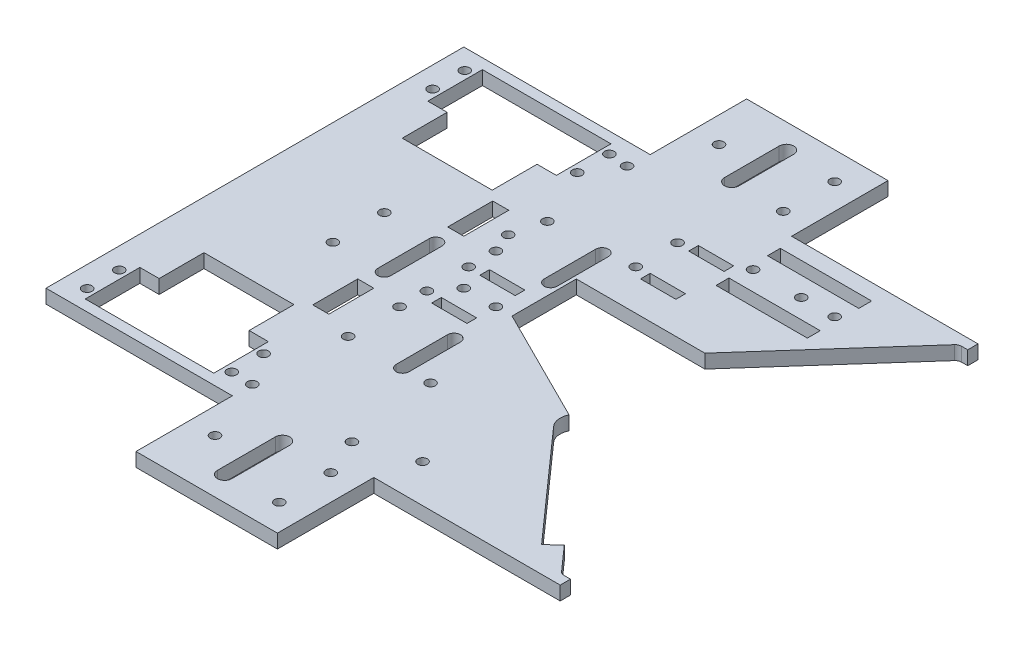
from build123d import *

# Parameters (mm, degrees)
BOSS_EXTRUDE1_DEPTH = 4.3
CUT_EXTRUDE1_DEPTH  = 4.5
FILLET1_R           = 2
CUT_EXTRUDE2_DEPTH  = 10
SKETCH8_R           = 1.5
CUT_EXTRUDE3_DEPTH  = 10
SKETCH9_R           = 1.5
CUT_EXTRUDE4_DEPTH  = 10
CUT_EXTRUDE5_DEPTH  = 10
SKETCH11_R          = 1.5
CUT_EXTRUDE6_DEPTH  = 10
SKETCH12_R          = 1.5
CUT_EXTRUDE7_DEPTH  = 10
SKETCH7_R           = 1.5
SKETCH7_W           = 11
SKETCH7_H           = 3
CUT_EXTRUDE8_DEPTH  = 9
SKETCH13_R          = 1.5
CUT_EXTRUDE9_DEPTH  = 10
SKETCH14_R          = 1.5
CUT_EXTRUDE10_DEPTH = 10
SKETCH15_W          = 5
SKETCH15_H          = 14
CUT_EXTRUDE11_DEPTH = 10
SKETCH16_R          = 1.5
CUT_EXTRUDE12_DEPTH = 10
SKETCH18_R          = 1.5
SKETCH18_W          = 28.4
SKETCH18_H          = 4
CUT_EXTRUDE13_DEPTH = 10


with BuildPart() as part:
    # Sketch2 → Boss-Extrude1 (new body)
    with BuildSketch(Plane(origin=(0, 0, 0), x_dir=(1, 0, 0), z_dir=(0, 1, 0))):
        Polygon((0, 0), (0, 65), (58, 65), (58, 95), (102, 95), (102, 65), (160, 65), (160, 0), align=None)
    extrude(amount=BOSS_EXTRUDE1_DEPTH)

    # Mirror1: part across plane


with BuildPart() as part_1:
    add(part.part)
    add(part.part.mirror(Plane(origin=(0, 4.3, 0), x_dir=(1, 0, 0), z_dir=(0, 0, -1))))

    # Sketch3 → Cut-Extrude1 (cut)
    with BuildSketch(Plane(origin=(0, 4.3, 0), x_dir=(1, 0, 0), z_dir=(0, 1, 0))):
        Polygon((160, -61.8), (160, 61.8), (157.156451185, 61.8), (120.012594795, 20), (80.012594795, 20), (80.012594795, 0), (120, -20), (157.155555556, -61.8), align=None)
    extrude(amount=-CUT_EXTRUDE1_DEPTH, mode=Mode.SUBTRACT)

    # Fillet1
    fillet1_edges = [part_1.edges().sort_by_distance(p)[0] for p in [
        (157.156451185, 2.15, -61.8),
        (157.155555556, 2.15, 61.8),
    ]]
    fillet(fillet1_edges, radius=FILLET1_R)

    # Sketch6 → Cut-Extrude2 (cut)
    with BuildSketch(Plane(origin=(0, 4.3, 0), x_dir=(1, 0, 0), z_dir=(0, 1, 0))):
        Polygon((9, -61.8), (49, -61.8), (49, -44.8), (43, -44.8), (43, -30.841820122), (15, -30.841820122), (15, -44.8), (9, -44.8), align=None)
        Polygon((9, 44.8), (15, 44.8), (15, 30.841820122), (43, 30.841820122), (43, 44.8), (49, 44.8), (49, 61.8), (9, 61.8), align=None)
    extrude(amount=-CUT_EXTRUDE2_DEPTH, mode=Mode.SUBTRACT)

    # Sketch8 → Cut-Extrude3 (cut)
    with BuildSketch(Plane(origin=(0, 4.3, 0), x_dir=(1, 0, 0), z_dir=(0, 1, 0))):
        with Locations((6.5, 58.8)):
            Circle(SKETCH8_R)
        with Locations((6.5, 48.8)):
            Circle(SKETCH8_R)
        with Locations((51.5, 48.8)):
            Circle(SKETCH8_R)
        with Locations((51.5, 58.8)):
            Circle(SKETCH8_R)
        with Locations((6.5, -48.7)):
            Circle(SKETCH8_R)
        with Locations((6.5, -58.7)):
            Circle(SKETCH8_R)
        with Locations((51.5, -58.7)):
            Circle(SKETCH8_R)
        with Locations((51.5, -48.8)):
            Circle(SKETCH8_R)
    extrude(amount=-CUT_EXTRUDE3_DEPTH, mode=Mode.SUBTRACT)

    # Sketch9 → Cut-Extrude4 (cut)
    with BuildSketch(Plane.XZ):
        with Locations((94, 70.4)):
            Circle(SKETCH9_R)
        with Locations((66, 78.4)):
            Circle(SKETCH9_R)
        with Locations((66, -78.4)):
            Circle(SKETCH9_R)
        with Locations((94, -86.4)):
            Circle(SKETCH9_R)
        with Locations((94, 86.4)):
            Circle(SKETCH9_R)
        with Locations((94, -70.4)):
            Circle(SKETCH9_R)
        with BuildLine():
            Line((75.75, 69.4), (75.75, 87.4))
            ThreePointArc((75.75, 87.4), (78, 89.65), (80.25, 87.4))
            Line((80.25, 87.4), (80.25, 69.4))
            ThreePointArc((80.25, 69.4), (78, 67.15), (75.75, 69.4))
        make_face()
        with BuildLine():
            Line((75.75, -87.4), (75.75, -70.4))
            ThreePointArc((75.75, -70.4), (78, -68.15), (80.25, -70.4))
            Line((80.25, -70.4), (80.25, -87.4))
            ThreePointArc((80.25, -87.4), (78, -89.65), (75.75, -87.4))
        make_face()
    extrude(amount=-CUT_EXTRUDE4_DEPTH, mode=Mode.SUBTRACT)

    # Sketch10 → Cut-Extrude5 (cut)
    with BuildSketch(Plane(origin=(0, 4.3, 0), x_dir=(1, 0, 0), z_dir=(0, 1, 0))):
        with BuildLine():
            Line((123.321819194, -23.737046593), (149.896372747, -53.633419341))
            Line((149.896372747, -53.633419341), (146.159326154, -56.955238535))
            Line((146.159326154, -56.955238535), (116.262953407, -23.321819194))
            ThreePointArc((116.262953407, -23.321819194), (120.29361011, -15.008628134), (123.321819194, -23.737046593))
        make_face()
    extrude(amount=-CUT_EXTRUDE5_DEPTH, mode=Mode.SUBTRACT)

    # Sketch11 → Cut-Extrude6 (cut)
    with BuildSketch(Plane.XZ):
        with BuildLine():
            ThreePointArc((79, 31.031280577), (77, 33.031280577), (75, 31.031280577))
            Line((75, 31.031280577), (75, 15.031280577))
            ThreePointArc((75, 15.031280577), (77, 13.031280577), (79, 15.031280577))
            Line((79, 15.031280577), (79, 31.031280577))
        make_face()
        with BuildLine():
            ThreePointArc((75, -31.031280577), (77, -33.031280577), (79, -31.031280577))
            Line((79, -31.031280577), (79, -15.031280577))
            ThreePointArc((79, -15.031280577), (77, -13.031280577), (75, -15.031280577))
            Line((75, -15.031280577), (75, -31.031280577))
        make_face()
        with Locations((60, 31)):
            Circle(SKETCH11_R)
        with Locations((60, 15)):
            Circle(SKETCH11_R)
        with Locations((60, -15)):
            Circle(SKETCH11_R)
        with Locations((60, -31)):
            Circle(SKETCH11_R)
    extrude(amount=-CUT_EXTRUDE6_DEPTH, mode=Mode.SUBTRACT)

    # Sketch12 → Cut-Extrude7 (cut)
    with BuildSketch(Plane(origin=(0, 0, 0), x_dir=(-1, 0, 0), z_dir=(0, -1, 0))):
        with BuildLine():
            ThreePointArc((-50.262723036, -8), (-48.262723036, -10), (-46.262723036, -8))
            Line((-46.262723036, -8), (-46.262723036, 8))
            ThreePointArc((-46.262723036, 8), (-48.262723036, 10), (-50.262723036, 8))
            Line((-50.262723036, 8), (-50.262723036, -8))
        make_face()
        with Locations((-32.262723036, -8)):
            Circle(SKETCH12_R)
        with Locations((-32.262723036, 8)):
            Circle(SKETCH12_R)
    extrude(amount=-CUT_EXTRUDE7_DEPTH, mode=Mode.SUBTRACT)

    # Sketch7 → Cut-Extrude8 (cut)
    with BuildSketch(Plane(origin=(0, 4.3, 0), x_dir=(1, 0, 0), z_dir=(0, 1, 0))):
        with Locations((60.012594795, -6.5)):
            Circle(SKETCH7_R)
        with Locations((60.012594795, 6.5)):
            Circle(SKETCH7_R)
        with Locations((86, 32.5)):
            Circle(SKETCH7_R)
        with Locations((86, 45.5)):
            Circle(SKETCH7_R)
        with Locations((69.5, -7.5)):
            Rectangle(SKETCH7_W, SKETCH7_H)
        with Locations((69.5, 7.5)):
            Rectangle(SKETCH7_W, SKETCH7_H)
        with Locations((95.487405205, 31.5)):
            Rectangle(SKETCH7_W, SKETCH7_H)
        with Locations((95.487405205, 46.5)):
            Rectangle(SKETCH7_W, SKETCH7_H)
    extrude(amount=-CUT_EXTRUDE8_DEPTH, mode=Mode.SUBTRACT)

    # Sketch13 → Cut-Extrude9 (cut)
    with BuildSketch(Plane(origin=(0, 4.3, 0), x_dir=(1, 0, 0), z_dir=(0, 1, 0))):
        with Locations((75, 0)):
            Circle(SKETCH13_R)
        with Locations((65, 0)):
            Circle(SKETCH13_R)
    extrude(amount=-CUT_EXTRUDE9_DEPTH, mode=Mode.SUBTRACT)

    # Sketch14 → Cut-Extrude10 (cut)
    with BuildSketch(Plane(origin=(0, 4.3, 0), x_dir=(1, 0, 0), z_dir=(0, 1, 0))):
        with Locations((57.5, 58.3)):
            Circle(SKETCH14_R)
        with Locations((57.5, 21.3)):
            Circle(SKETCH14_R)
        with Locations((85.370034901, -30.712866901)):
            Circle(SKETCH14_R)
        with Locations((105.300950066, -53.135146462)):
            Circle(SKETCH14_R)
    extrude(amount=-CUT_EXTRUDE10_DEPTH, mode=Mode.SUBTRACT)

    # Sketch15 → Cut-Extrude11 (cut)
    with BuildSketch(Plane(origin=(0, 4.3, 0), x_dir=(1, 0, 0), z_dir=(0, 1, 0))):
        with Locations((48.5, 21)):
            Rectangle(SKETCH15_W, SKETCH15_H)
        with Locations((48.5, -21)):
            Rectangle(SKETCH15_W, SKETCH15_H)
    extrude(amount=-CUT_EXTRUDE11_DEPTH, mode=Mode.SUBTRACT)

    # Sketch16 → Cut-Extrude12 (cut)
    with BuildSketch(Plane(origin=(0, 4.3, 0), x_dir=(1, 0, 0), z_dir=(0, 1, 0))):
        with Locations((89, -58.8)):
            Circle(SKETCH16_R)
        with Locations((58, -58.8)):
            Circle(SKETCH16_R)
    extrude(amount=-CUT_EXTRUDE12_DEPTH, mode=Mode.SUBTRACT)

    # Sketch18 → Cut-Extrude13 (cut)
    with BuildSketch(Plane(origin=(0, 4.3, 0), x_dir=(1, 0, 0), z_dir=(0, 1, 0))):
        with Locations((130.4, 50)):
            Circle(SKETCH18_R)
        with Locations((120, 50)):
            Circle(SKETCH18_R)
        with Locations((105, 50)):
            Circle(SKETCH18_R)
        with Locations((117.7, 58)):
            Rectangle(SKETCH18_W, SKETCH18_H)
        with Locations((117.7, 42)):
            Rectangle(SKETCH18_W, SKETCH18_H)
    extrude(amount=-CUT_EXTRUDE13_DEPTH, mode=Mode.SUBTRACT)


solid = part_1.part
